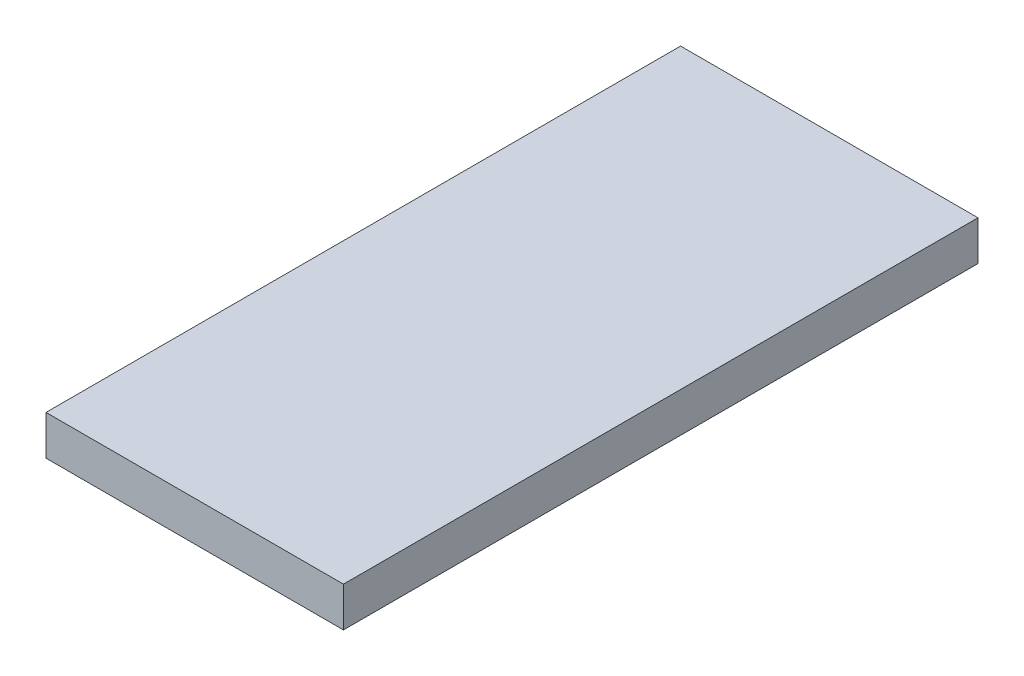
from build123d import *

# Parameters (mm, degrees)
SALIENTE_EXTRUIR1_DEPTH = 320


with BuildPart() as part:
    # Croquis1 → Saliente-Extruir1 (new body)
    with BuildSketch(Plane.XY):
        Polygon((-63.156112569, -3.181911015), (-63.156112569, -3.953283382), (86.843887431, -3.953283382), (86.843887431, 16.046716618), (-63.156112569, 16.046716618), align=None)
    extrude(amount=SALIENTE_EXTRUIR1_DEPTH)


solid = part.part
